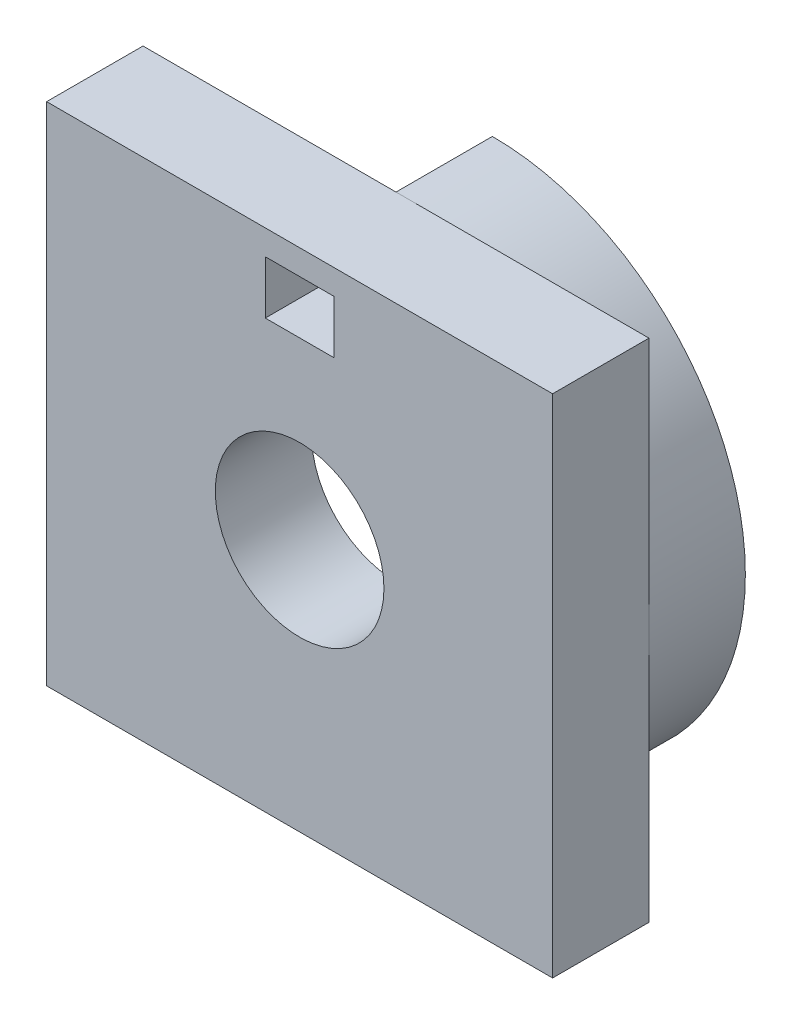
from build123d import *

# Parameters (mm, degrees)
SKETCH1_W           = 21
SKETCH1_H           = 21
SKETCH1_R           = 3.5
BOSS_EXTRUDE1_DEPTH = 4
BOSS_EXTRUDE2_DEPTH = 4
SKETCH3_W           = 2.85
SKETCH3_H           = 2.205413133
CUT_EXTRUDE1_DEPTH  = 4


with BuildPart() as part:
    # Sketch1 → Boss-Extrude1 (new body)
    with BuildSketch(Plane.XY):
        Rectangle(SKETCH1_W, SKETCH1_H)
        Circle(SKETCH1_R, mode=Mode.SUBTRACT)
    extrude(amount=BOSS_EXTRUDE1_DEPTH)

    # Sketch2 → Boss-Extrude2 (add)
    with BuildSketch(Plane(origin=(0, 0, 0), x_dir=(-1, 0, 0), z_dir=(0, 0, -1))):
        with BuildLine():
            Line((0, 10.5), (0, 9))
            ThreePointArc((0, 9), (-9, 0), (0, -9))
            Line((0, -9), (0, -10.5))
            ThreePointArc((0, -10.5), (-10.5, 0), (0, 10.5))
        make_face()
    extrude(amount=BOSS_EXTRUDE2_DEPTH)

    # Sketch3 → Cut-Extrude1 (cut)
    with BuildSketch(Plane(origin=(0, 0, 0), x_dir=(-1, 0, 0), z_dir=(0, 0, -1))):
        with Locations((0, 8.361109671)):
            Rectangle(SKETCH3_W, SKETCH3_H)
    extrude(amount=-CUT_EXTRUDE1_DEPTH, mode=Mode.SUBTRACT)


solid = part.part
